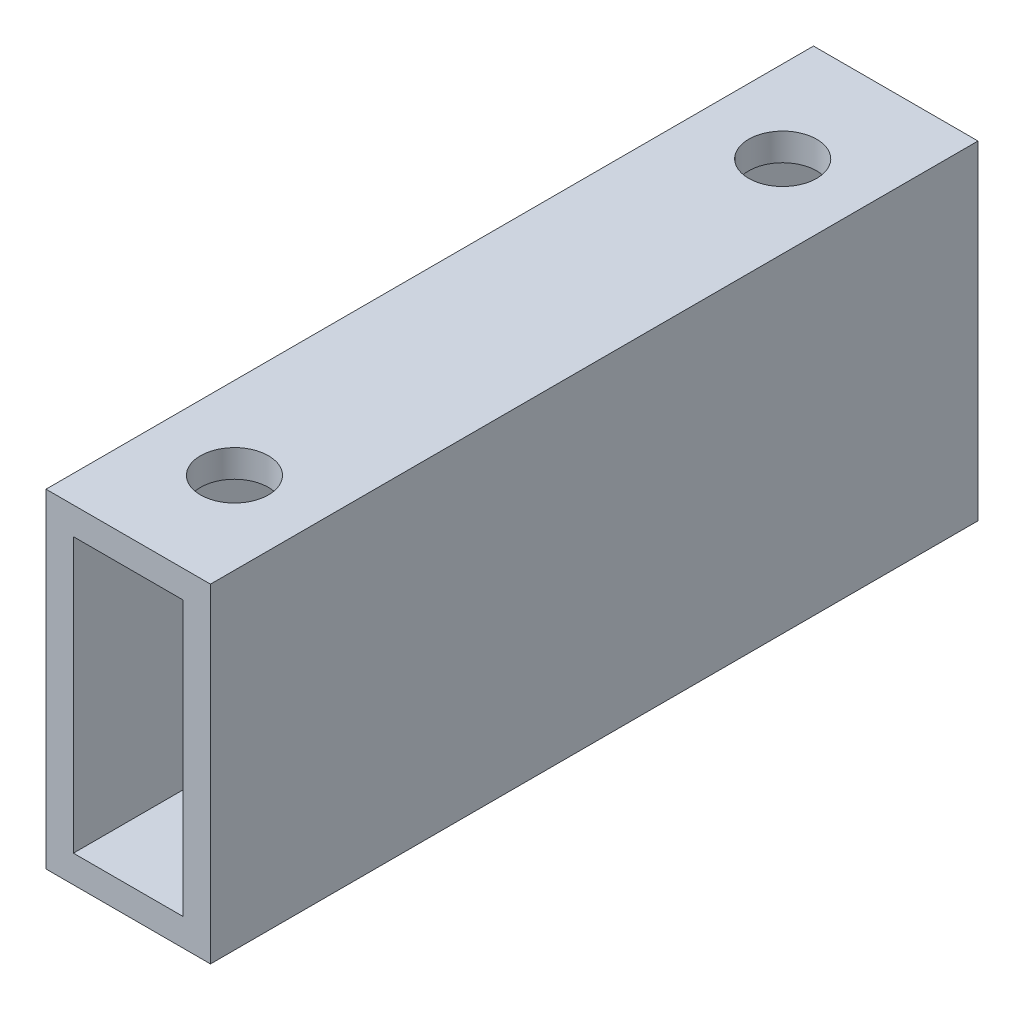
from build123d import *

# Parameters (mm, degrees)
SKETCH1_W           = 19.05
SKETCH1_H           = 38.1
SKETCH1_W_2         = 12.7
SKETCH1_H_2         = 31.75
BOSS_EXTRUDE1_DEPTH = 88.9
SKETCH2_R           = 2.778125
CUT_EXTRUDE1_DEPTH  = 98.188196943
CUT_EXTRUDE2_REACH  = 99.188
SKETCH3_R           = 3.937


with BuildPart() as part:
    # Sketch1 → Boss-Extrude1 (new body)
    with BuildSketch(Plane.XY):
        Rectangle(SKETCH1_W, SKETCH1_H)
        Rectangle(SKETCH1_W_2, SKETCH1_H_2, mode=Mode.SUBTRACT)
    extrude(amount=BOSS_EXTRUDE1_DEPTH)

    # Sketch2 → Cut-Extrude1 (cut, through all)
    with BuildSketch(Plane(origin=(0, 19.05, 0), x_dir=(1, 0, 0), z_dir=(0, 1, 0))):
        with Locations(Location((0, -76.596875, 0), (0, 0, 270))):
            Circle(SKETCH2_R)
        with Locations(Location((0, -13.096875, 0), (0, 0, 270))):
            Circle(SKETCH2_R)
    extrude(amount=-CUT_EXTRUDE1_DEPTH, mode=Mode.SUBTRACT)

    # Sketch3 → Cut-Extrude2 (cut, up to next)
    with BuildSketch(Plane(origin=(0, 19.05, 0), x_dir=(1, 0, 0), z_dir=(0, 1, 0)), mode=Mode.PRIVATE) as cut_extrude2_sk1:
        with Locations(Location((0, -76.596875, 0), (0, 0, 270))):
            Circle(SKETCH3_R)
    cut_extrude2_tool1 = extrude(cut_extrude2_sk1.sketch, amount=-CUT_EXTRUDE2_REACH, mode=Mode.PRIVATE) & part.part
    # Sketch3 → Cut-Extrude2 (cut, up to next)
    with BuildSketch(Plane(origin=(0, 19.05, 0), x_dir=(1, 0, 0), z_dir=(0, 1, 0)), mode=Mode.PRIVATE) as cut_extrude2_sk2:
        with Locations(Location((0, -13.096875, 0), (0, 0, 270))):
            Circle(SKETCH3_R)
    cut_extrude2_tool2 = extrude(cut_extrude2_sk2.sketch, amount=-CUT_EXTRUDE2_REACH, mode=Mode.PRIVATE) & part.part
    add(cut_extrude2_tool1.solids().sort_by_distance((0, 19.05, 76.596875))[0], mode=Mode.SUBTRACT)
    add(cut_extrude2_tool2.solids().sort_by_distance((0, 19.05, 13.096875))[0], mode=Mode.SUBTRACT)


solid = part.part
